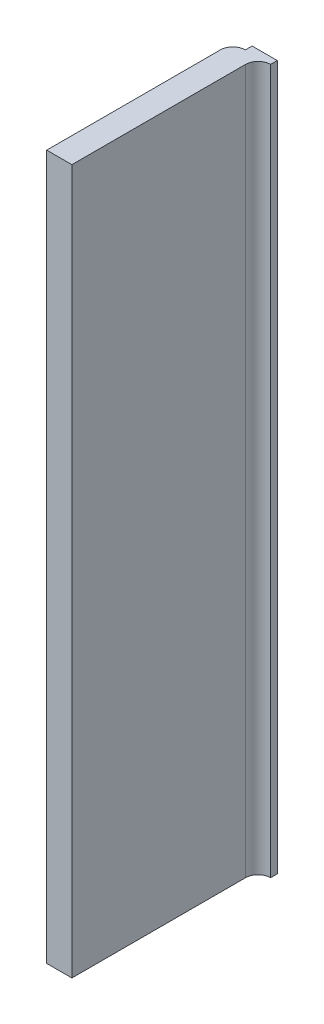
from build123d import *

# Parameters (mm, degrees)
BOSS_EXTRUDE1_DEPTH = 168


with BuildPart() as part:
    # Sketch1 → Boss-Extrude1 (new body)
    with BuildSketch(Plane(origin=(0, 0, 0), x_dir=(1, 0, 0), z_dir=(0, 1, 0))):
        with BuildLine():
            Line((5.814470124, 4.566536611), (2.829130053, 4.566536611))
            Line((2.829130053, 4.566536611), (2.829130053, -0.01880346))
            ThreePointArc((2.829130053, -0.01880346), (3.703515915, 2.092150748), (5.814470124, 2.966536611))
            Line((5.814470124, 2.966536611), (5.814470124, 4.566536611))
        make_face()
        with BuildLine():
            Line((2.829130053, -0.01880346), (2.829130053, 4.566536611))
            Line((2.829130053, 4.566536611), (-0.185529876, 4.566536611))
            Line((-0.185529876, 4.566536611), (-0.185529876, 2.966536611))
            ThreePointArc((-0.185529876, 2.966536611), (-2.296484085, 2.092150748), (-3.170869947, -0.01880346))
            Line((-3.170869947, -0.01880346), (-3.170869947, -41.433463389))
            Line((-3.170869947, -41.433463389), (2.829130053, -41.433463389))
            Line((2.829130053, -41.433463389), (2.829130053, -0.01880346))
        make_face()
    extrude(amount=BOSS_EXTRUDE1_DEPTH)


solid = part.part
